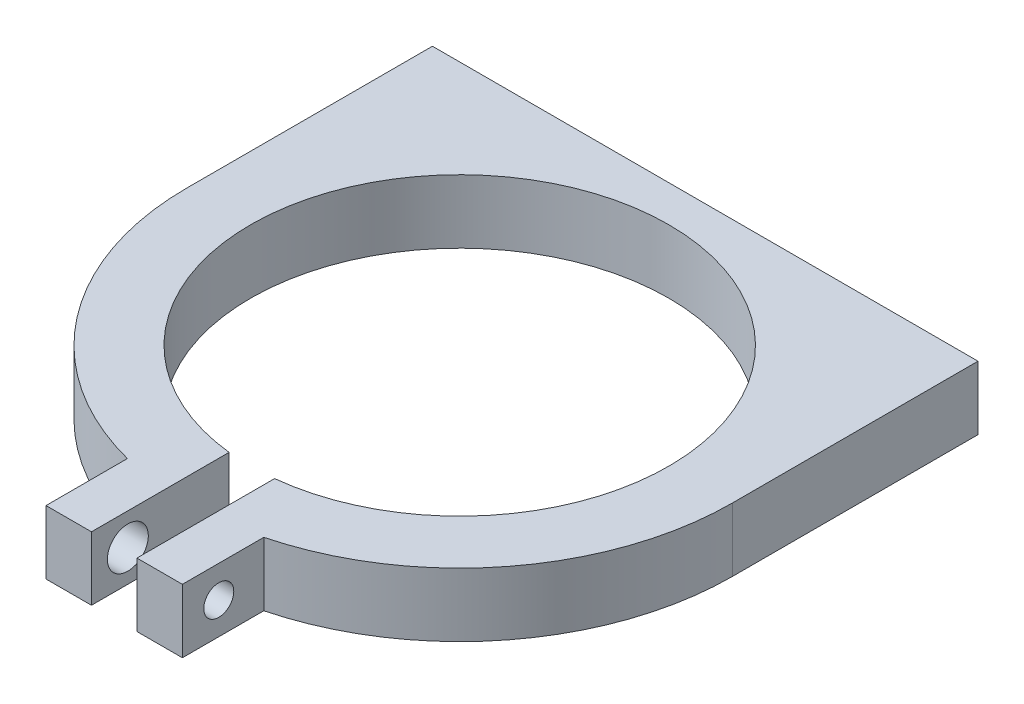
from build123d import *

# Parameters (mm, degrees)
BOSS_EXTRUDE1_DEPTH   = 3.5
M4_TAPPED_HOLE2_D     = 3.3
M4_TAPPED_HOLE2_DEPTH = 9.008579979
M4_TAPPED_HOLE2_TIP   = 0.991420021
CUT_EXTRUDE1_REACH    = 55.502
SKETCH4_R             = 2.25
M4_TAPPED_HOLE1_D     = 3.3
M4_TAPPED_HOLE1_DEPTH = 9.108579979
M4_TAPPED_HOLE1_TIP   = 0.991420021


with BuildPart() as part:
    # Sketch1 → Boss-Extrude1 (new, symmetric)
    with BuildSketch(Plane(origin=(0, 0, 0), x_dir=(1, 0, 0), z_dir=(0, 1, 0))):
        with BuildLine():
            Line((-30, 0), (-30, 27))
            Line((-30, 27), (30, 27))
            Line((30, 27), (30, 0))
            ThreePointArc((30, 0), (23.717082451, -18.371173071), (7.5, -29.047375097))
            Line((7.5, -29.047375097), (7.5, -38))
            Line((7.5, -38), (2.5, -38))
            Line((2.5, -38), (2.5, -22.86372673))
            ThreePointArc((2.5, -22.86372673), (0, 23), (-2.5, -22.86372673))
            Line((-2.5, -22.86372673), (-2.5, -38))
            Line((-2.5, -38), (-7.5, -38))
            Line((-7.5, -38), (-7.5, -29.047375097))
            ThreePointArc((-7.5, -29.047375097), (-23.717082451, -18.371173071), (-30, 0))
        make_face()
    extrude(amount=BOSS_EXTRUDE1_DEPTH, both=True)

    # M4 Tapped Hole2
    with Locations(Plane(origin=(-24.75, 0, -27), x_dir=(-1, 0, 0), z_dir=(0, 0, -1))):
        with Locations((0, 0), (-49.5, 0)):
            Hole(M4_TAPPED_HOLE2_D / 2, depth=M4_TAPPED_HOLE2_DEPTH)
            with Locations((0, 0, -(M4_TAPPED_HOLE2_DEPTH + M4_TAPPED_HOLE2_TIP / 2))):  # 118° drill point
                Cone(0, M4_TAPPED_HOLE2_D / 2, M4_TAPPED_HOLE2_TIP, mode=Mode.SUBTRACT)

    # Sketch4 → Cut-Extrude1 (cut, up to next)
    with BuildSketch(Plane.ZY.offset(7.5), mode=Mode.PRIVATE) as cut_extrude1_sk1:
        with Locations((34, 0)):
            Circle(SKETCH4_R)
    cut_extrude1_tool1 = extrude(cut_extrude1_sk1.sketch, amount=-CUT_EXTRUDE1_REACH, mode=Mode.PRIVATE) & part.part
    add(cut_extrude1_tool1.solids().sort_by_distance((-7.5, 0, 34))[0], mode=Mode.SUBTRACT)

    # M4 Tapped Hole1
    with Locations(Plane(origin=(7.5, 0, 34), x_dir=(0, 0, 1), z_dir=(1, 0, 0))):
        with Locations((0, 0)):
            Hole(M4_TAPPED_HOLE1_D / 2, depth=M4_TAPPED_HOLE1_DEPTH)
            with Locations((0, 0, -(M4_TAPPED_HOLE1_DEPTH + M4_TAPPED_HOLE1_TIP / 2))):  # 118° drill point
                Cone(0, M4_TAPPED_HOLE1_D / 2, M4_TAPPED_HOLE1_TIP, mode=Mode.SUBTRACT)


solid = part.part
